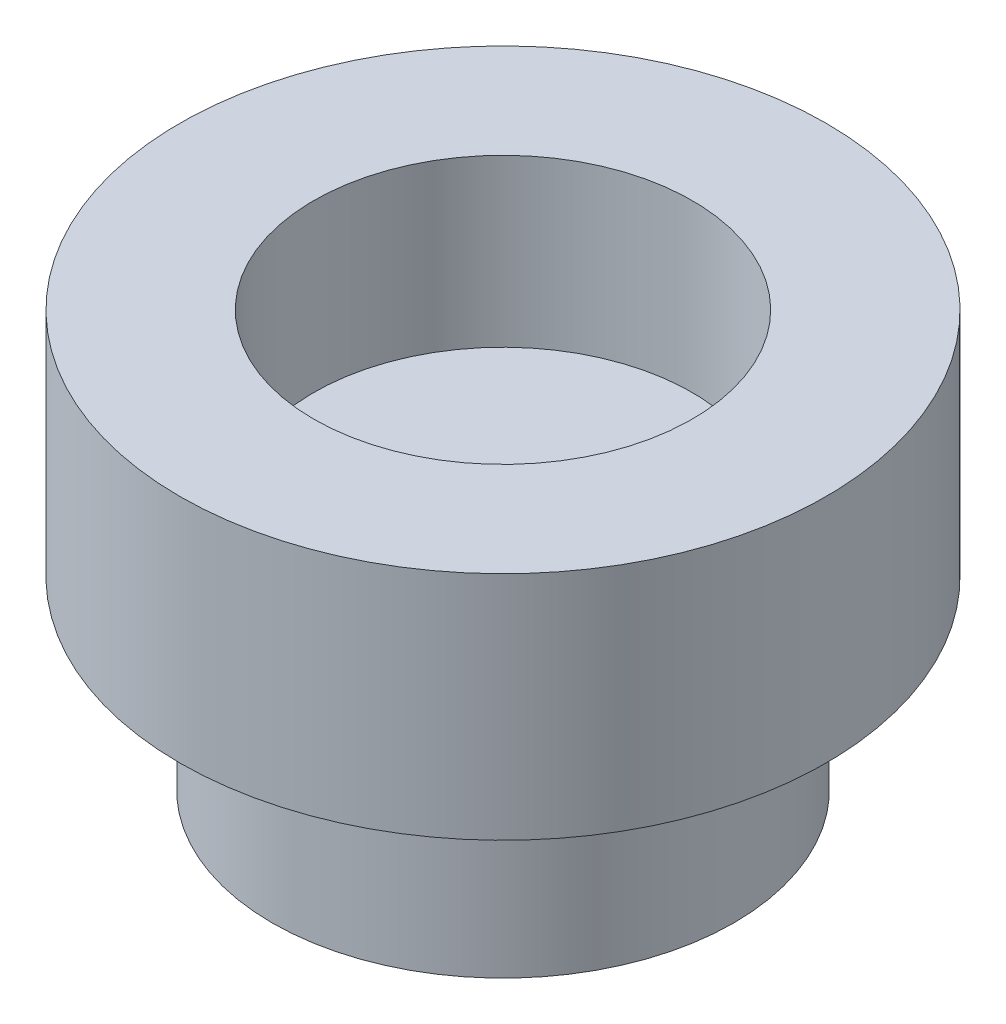
from build123d import *

# Parameters (mm, degrees)
SKETCH1_R           = 2.5
BOSS_EXTRUDE2_DEPTH = 4.5
SKETCH1_3_R         = 3.5
SKETCH1_3_R_2       = 2.5
BOSS_EXTRUDE3_DEPTH = 4.5
SKETCH1_4_R         = 3.5
SKETCH1_4_R_2       = 2.5
CUT_EXTRUDE1_DEPTH  = 2
SKETCH2_R           = 2.05
CUT_EXTRUDE2_DEPTH  = 1.8


with BuildPart() as part:
    # Sketch1 → Boss-Extrude2 (new body)
    with BuildSketch(Plane(origin=(0, 0, 0), x_dir=(1, 0, 0), z_dir=(0, 1, 0))):
        with Locations(Location((0, 0, 0), (0, 0, 270))):
            Circle(SKETCH1_R)
    extrude(amount=BOSS_EXTRUDE2_DEPTH)

    # Sketch1<3> → Boss-Extrude3 (add)
    with BuildSketch(Plane(origin=(0, 0, 0), x_dir=(1, 0, 0), z_dir=(0, 1, 0))):
        with Locations(Location((0, 0, 0), (0, 0, 270))):
            Circle(SKETCH1_3_R)
        Circle(SKETCH1_3_R_2, mode=Mode.SUBTRACT)
    extrude(amount=BOSS_EXTRUDE3_DEPTH)

    # Sketch1<4> → Cut-Extrude1 (cut)
    with BuildSketch(Plane(origin=(0, 0, 0), x_dir=(1, 0, 0), z_dir=(0, 1, 0))):
        with Locations(Location((0, 0, 0), (0, 0, 270))):
            Circle(SKETCH1_4_R)
        with Locations(Location((0, 0, 0), (0, 0, 270))):
            Circle(SKETCH1_4_R_2, mode=Mode.SUBTRACT)
    extrude(amount=CUT_EXTRUDE1_DEPTH, mode=Mode.SUBTRACT)

    # Sketch2 → Cut-Extrude2 (cut)
    with BuildSketch(Plane(origin=(0, 4.5, 0), x_dir=(1, 0, 0), z_dir=(0, 1, 0))):
        with Locations(Location((0, 0, 0), (0, 0, 270))):
            Circle(SKETCH2_R)
    extrude(amount=-CUT_EXTRUDE2_DEPTH, mode=Mode.SUBTRACT)


solid = part.part
